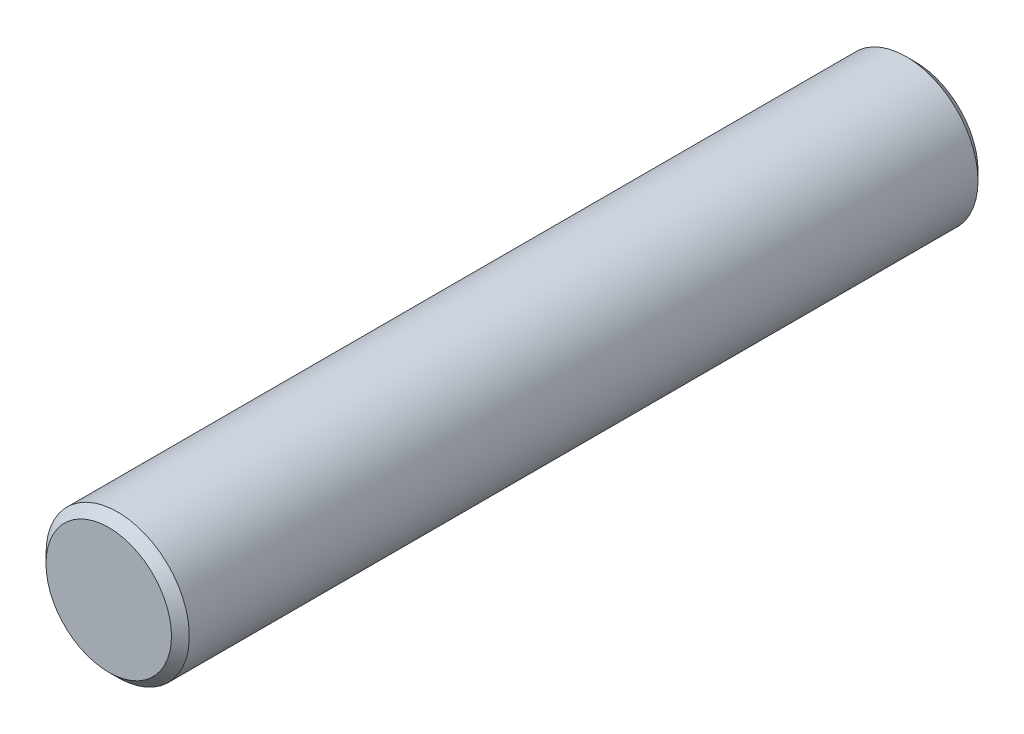
from build123d import *

# Parameters (mm, degrees)
ESQUISSE1_R        = 4
BOSS_EXTRU_1_DEPTH = 45
CHANFREIN1_SIZE    = 0.5


with BuildPart() as part:
    # Esquisse1 → Boss.-Extru.1 (new body)
    with BuildSketch(Plane.XY):
        with Locations(Location((0, 0, 0), (0, 0, 180))):
            Circle(ESQUISSE1_R)
    extrude(amount=BOSS_EXTRU_1_DEPTH)

    # Chanfrein1
    chanfrein1_edges = [part.edges().sort_by_distance(p)[0] for p in [
        (4, 0, 0),
        (4, 0, 45),
    ]]
    chamfer(chanfrein1_edges, length=CHANFREIN1_SIZE)


solid = part.part
